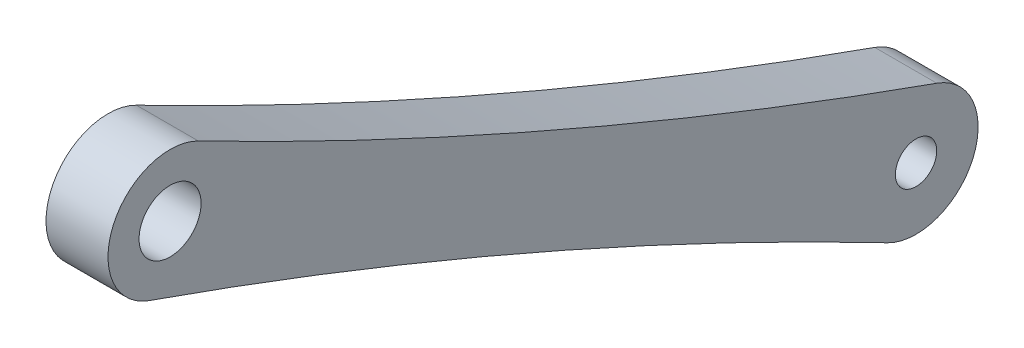
from build123d import *

# Parameters (mm, degrees)
SKETCH2_R               = 1.375
SKETCH2_R_2             = 1
BOSS_EXTRUDE1_DEPTH     = 3
SCALE1_SCALE            = 2
SKETCH3_R               = 3
CUT_EXTRUDE1_DEPTH      = 168.69505013
CUT_EXTRUDE2_DEPTH      = 168.69505013
CUT_EXTRUDE2_DEPTH_BACK = 168.69505013


with BuildPart() as part:
    # Sketch2 → Boss-Extrude1 (new body)
    with BuildSketch(Plane.YZ):
        with BuildLine():
            ThreePointArc((52.261817642, 64.649681199), (55.722453046, 48.775220907), (69.655917155, 57.131838936))
            ThreePointArc((69.655917155, 57.131838936), (73.702355413, 73.305037878), (82.709556836, 87.334162909))
            ThreePointArc((82.709556836, 87.334162909), (79.248921432, 103.208623201), (65.315457322, 94.852005173))
            ThreePointArc((65.315457322, 94.852005173), (61.269019064, 78.67880623), (52.261817642, 64.649681199))
        make_face()
        with Locations(Location((75.281557454, 94.029297351, 0), (0, 0, 270))):
            Circle(SKETCH2_R, mode=Mode.SUBTRACT)
        with Locations(Location((59.689817023, 57.954546758, 0), (0, 0, 270))):
            Circle(SKETCH2_R_2, mode=Mode.SUBTRACT)
    extrude(amount=BOSS_EXTRUDE1_DEPTH)


with BuildPart() as part_1:
    # Scale1: scaled about (1.5, 67.462360836, 75.937951546)
    add(part.part.scale(SCALE1_SCALE).moved(Location((-1.5, -67.462360836, -75.937951546))))

    # Sketch3 → Cut-Extrude1 (cut, through all)
    with BuildSketch(Plane.YZ.offset(4.5)):
        with Locations(Location((83.100754073, 112.120643155, 0), (0, 0, 270))):
            Circle(SKETCH3_R)
    extrude(amount=-CUT_EXTRUDE1_DEPTH, mode=Mode.SUBTRACT)

    # Sketch4 → Cut-Extrude2 (cut, two sides: drawn at the far end of the back side and taken through both)
    with BuildSketch(Plane.YZ.offset(4.5).offset(-CUT_EXTRUDE2_DEPTH_BACK)):
        with BuildLine():
            ThreePointArc((63.168553809, 113.7660588), (55.075677293, 81.419660915), (37.061274447, 53.361410853))
            ThreePointArc((37.061274447, 53.361410853), (43.982545256, 21.612490269), (71.849473474, 38.325726326))
            ThreePointArc((71.849473474, 38.325726326), (79.94234999, 70.672124211), (97.956752836, 98.730374273))
            ThreePointArc((97.956752836, 98.730374273), (91.035482027, 130.479294857), (63.168553809, 113.7660588))
        make_face()
        with BuildLine():
            ThreePointArc((77.437713, 114.103057293), (85.469954791, 117.633073469), (88.436192443, 109.375994289))
            ThreePointArc((88.436192443, 109.375994289), (71.804815123, 74.18921939), (57.57219549, 37.96568591))
            ThreePointArc((57.57219549, 37.96568591), (49.557643799, 34.454607819), (46.56128374, 42.675467541))
            add(Edge.make_bspline(
                [(46.57708347, 42.706756435), (46.571822916, 42.696339697), (46.566556342, 42.685910072), (46.56128374, 42.675467541)],
                knots=[0.950044559, 0.950044559, 0.950044559, 0.950044559, 0.950284721, 0.950284721, 0.950284721, 0.950284721], degree=3))
            ThreePointArc((46.57708347, 42.706756435), (46.585069243, 42.722124357), (46.593054528, 42.737492531))
            ThreePointArc((46.593054528, 42.737492531), (63.286743628, 77.87078496), (77.437713, 114.103057293))
        make_face(mode=Mode.SUBTRACT)
    extrude(amount=CUT_EXTRUDE2_DEPTH + CUT_EXTRUDE2_DEPTH_BACK, mode=Mode.SUBTRACT)


solid = part_1.part
